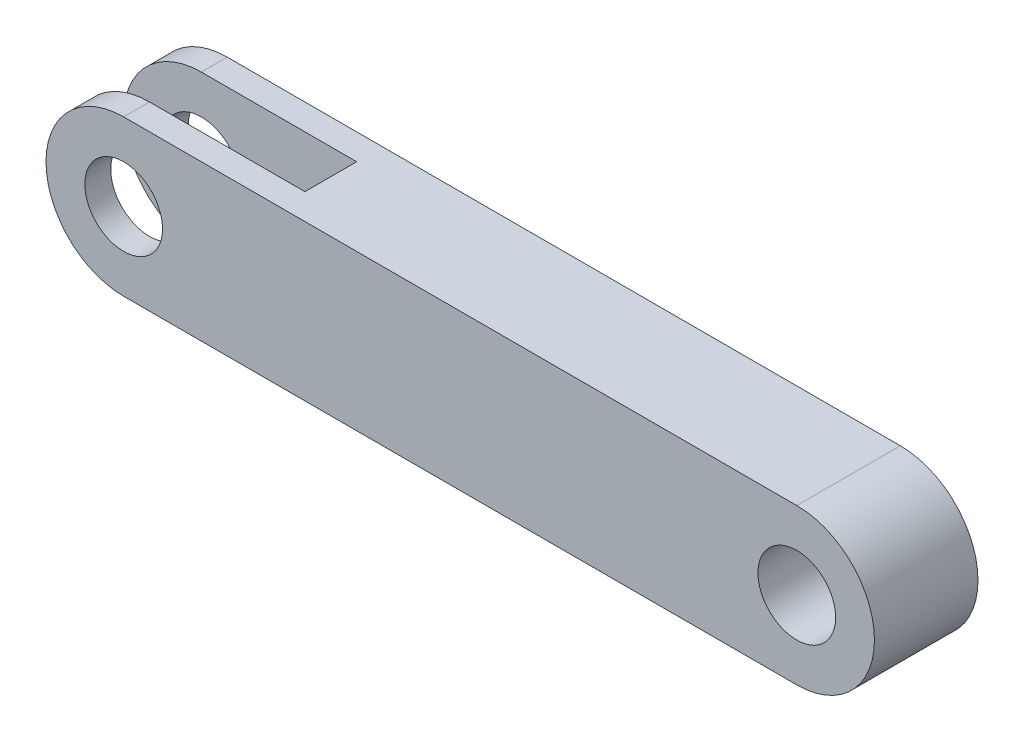
from build123d import *

# Parameters (mm, degrees)
SKETCH_1_R          = 3
EXTRUDE_1_DEPTH     = 8
SKETCH_2_W          = 18
SKETCH_2_H          = 4
CUT_EXTRUDE_1_DEPTH = 36.09985755


with BuildPart() as part:
    # 草图1 → 凸台-拉伸1 (new body)
    with BuildSketch(Plane.XY):
        with BuildLine():
            Line((-26, 6), (26, 6))
            ThreePointArc((26, 6), (32, 0), (26, -6))
            Line((26, -6), (-26, -6))
            ThreePointArc((-26, -6), (-32, 0), (-26, 6))
        make_face()
        with Locations((-26, 0)):
            Circle(SKETCH_1_R, mode=Mode.SUBTRACT)
        with Locations((26, 0)):
            Circle(SKETCH_1_R, mode=Mode.SUBTRACT)
    extrude(amount=EXTRUDE_1_DEPTH)

    # 草图2 → 切除-拉伸1 (cut, through all)
    with BuildSketch(Plane(origin=(0, 6, 0), x_dir=(1, 0, 0), z_dir=(0, 1, 0))):
        with Locations((-23, -4)):
            Rectangle(SKETCH_2_W, SKETCH_2_H)
    extrude(amount=-CUT_EXTRUDE_1_DEPTH, mode=Mode.SUBTRACT)


solid = part.part
